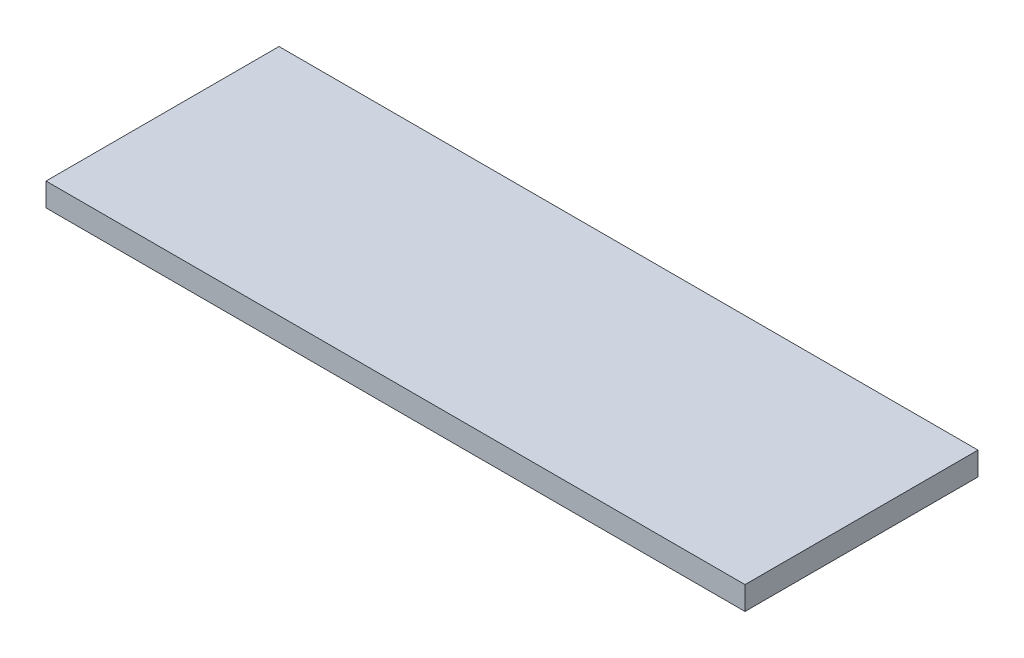
from build123d import *

# Parameters (mm, degrees)
SKETCH1_W           = 300
SKETCH1_H           = 100
BOSS_EXTRUDE1_DEPTH = 10


with BuildPart() as part:
    # Sketch1 → Boss-Extrude1 (new body)
    with BuildSketch(Plane(origin=(0, 0, 0), x_dir=(1, 0, 0), z_dir=(0, 1, 0))):
        Rectangle(SKETCH1_W, SKETCH1_H)
    extrude(amount=BOSS_EXTRUDE1_DEPTH)


solid = part.part
